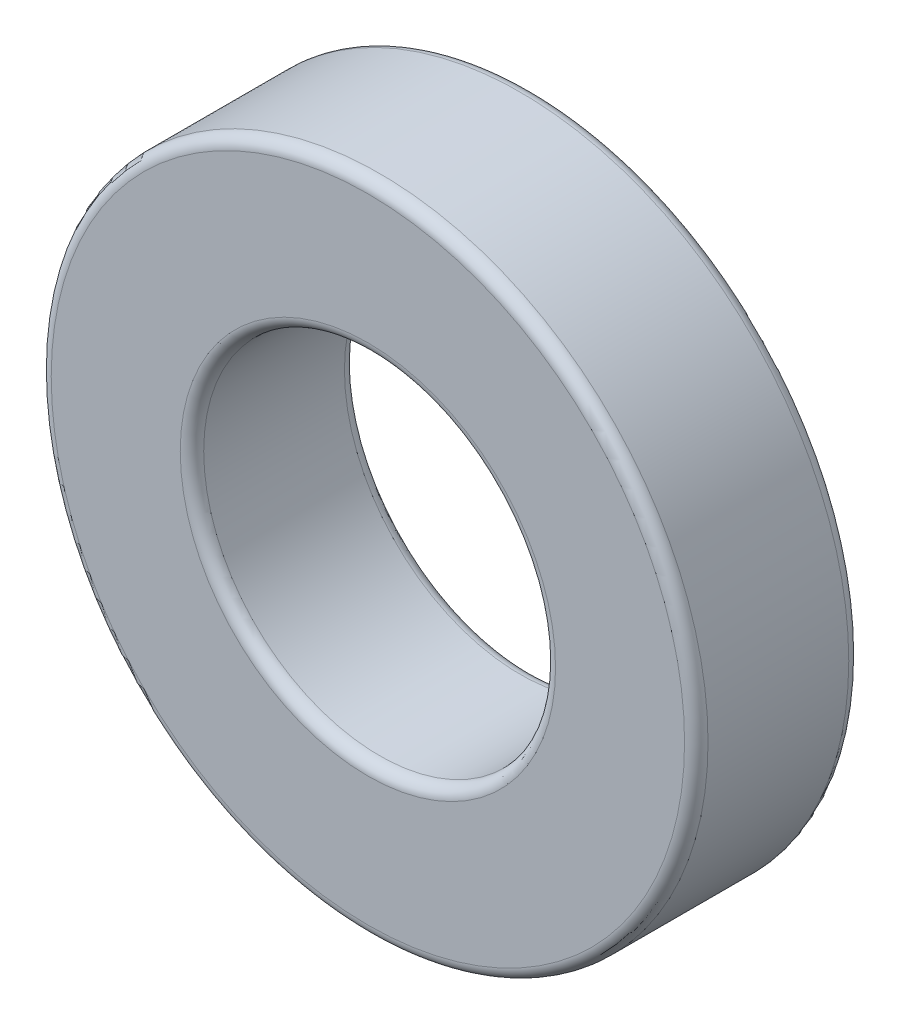
from build123d import *

# Parameters (mm, degrees)
SKETCH_1_R      = 14
SKETCH_1_R_2    = 7.5
EXTRUDE_1_DEPTH = 7
FILLET_1_R      = 0.5


with BuildPart() as part:
    # 草图1 → 拉伸1 (new body)
    with BuildSketch(Plane.XY):
        Circle(SKETCH_1_R)
        Circle(SKETCH_1_R_2, mode=Mode.SUBTRACT)
    extrude(amount=EXTRUDE_1_DEPTH)

    # 圆角1
    fillet_1_edges = [part.edges().sort_by_distance(p)[0] for p in [
        (-14, 0, 0),
        (-14, 0, 7),
        (-7.5, 0, 0),
        (-7.5, 0, 7),
    ]]
    fillet(fillet_1_edges, radius=FILLET_1_R)


solid = part.part
